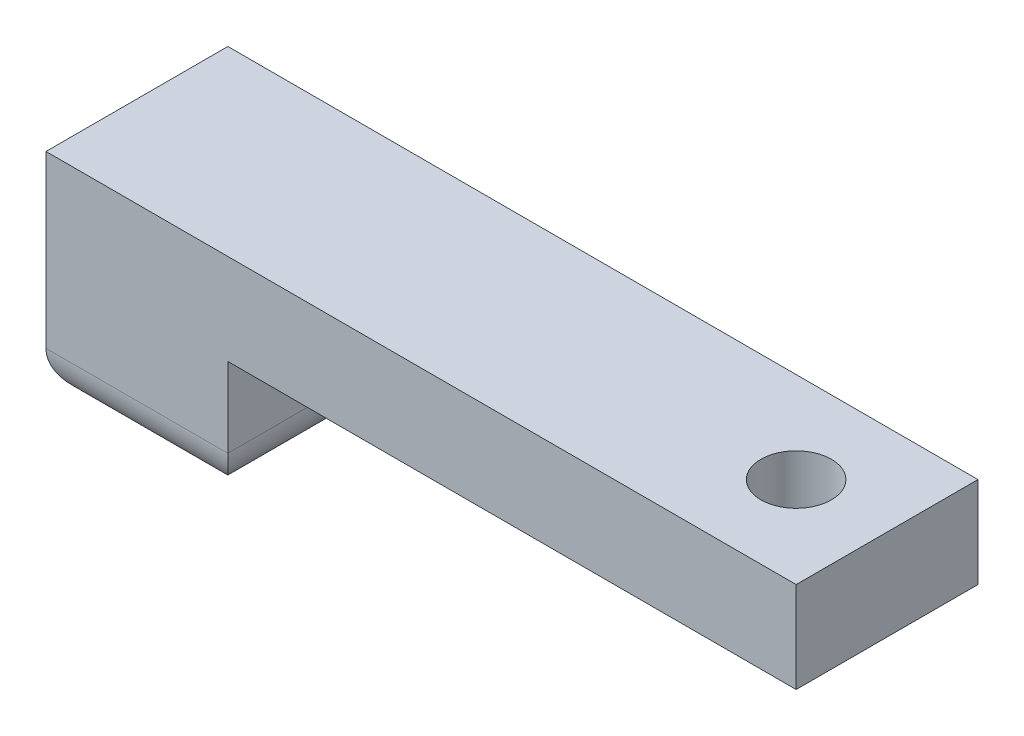
from build123d import *

# Parameters (mm, degrees)
SKETCH1_W           = 33
SKETCH1_H           = 8
SKETCH1_R           = 1.55
BOSS_EXTRUDE1_DEPTH = 4
SKETCH3_W           = 8
SKETCH3_H           = 8
BOSS_EXTRUDE2_DEPTH = 5.5
FILLET1_R           = 2


with BuildPart() as part:
    # Sketch1 → Boss-Extrude1 (new body)
    with BuildSketch(Plane(origin=(0, 0, 0), x_dir=(1, 0, 0), z_dir=(0, 1, 0))):
        with Locations((0.21875, 2.328125)):
            Rectangle(SKETCH1_W, SKETCH1_H)
        with Locations(Location((12.71875, 2.328125, 0), (0, 0, 270))):
            Circle(SKETCH1_R, mode=Mode.SUBTRACT)
    extrude(amount=BOSS_EXTRUDE1_DEPTH)

    # Sketch3 → Boss-Extrude2 (add)
    with BuildSketch(Plane.XZ):
        with Locations((-12.28125, -2.328125)):
            Rectangle(SKETCH3_W, SKETCH3_H)
    extrude(amount=BOSS_EXTRUDE2_DEPTH)

    # Fillet1
    fillet1_edges = [part.edges().sort_by_distance(p)[0] for p in [
        (-16.28125, -5.5, -2.328125),
        (-12.28125, -5.5, -6.328125),
        (-8.28125, -5.5, -2.328125),
        (-12.28125, -5.5, 1.671875),
    ]]
    fillet(fillet1_edges, radius=FILLET1_R)


solid = part.part
